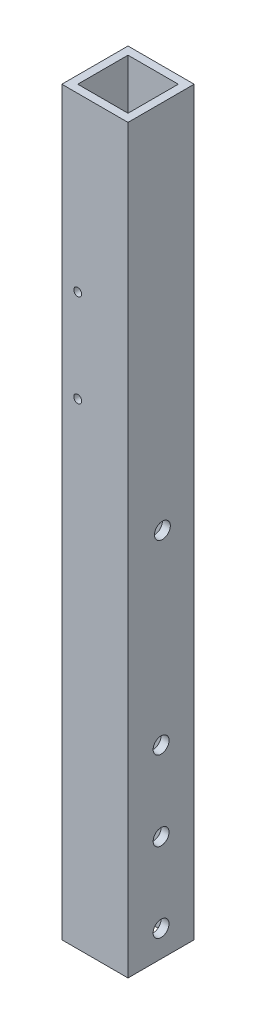
from build123d import *

# Parameters (mm, degrees)
SKETCH_1_W               = 25
SKETCH_1_H               = 25
SKETCH_1_W_2             = 19
SKETCH_1_H_2             = 19
EXTRUDE_1_DEPTH          = 280
SKETCH_2_R               = 3
CUT_EXTRUDE_1_DEPTH      = 283.223315833
CUT_EXTRUDE_2_DEPTH      = 283.223315833
CUT_EXTRUDE_2_DEPTH_BACK = 283.223315833
SKETCH_3_R               = 1.5


with BuildPart() as part:
    # 草图1 → 凸台-拉伸1 (new body)
    with BuildSketch(Plane(origin=(0, 0, 0), x_dir=(1, 0, 0), z_dir=(0, 1, 0))):
        with Locations((12.5, 12.5)):
            Rectangle(SKETCH_1_W, SKETCH_1_H)
        with Locations((12.5, 12.5)):
            Rectangle(SKETCH_1_W_2, SKETCH_1_H_2, mode=Mode.SUBTRACT)
    extrude(amount=EXTRUDE_1_DEPTH)

    # 草图2 → 切除-拉伸1 (cut, through all)
    with BuildSketch(Plane(origin=(0, 0, 0), x_dir=(0, 0, -1), z_dir=(1, 0, 0))):
        with Locations(Location((12.5, 10, 0), (0, 0, 180))):
            Circle(SKETCH_2_R)
        with Locations(Location((12.5, 40, 0), (0, 0, 180))):
            Circle(SKETCH_2_R)
        with Locations(Location((12.5, 70, 0), (0, 0, 180))):
            Circle(SKETCH_2_R)
        with Locations(Location((13, 140, 0), (0, 0, 180))):
            Circle(SKETCH_2_R)
    extrude(amount=CUT_EXTRUDE_1_DEPTH, mode=Mode.SUBTRACT)

    # 草图3 → 切除-拉伸2 (cut, two sides: drawn at the far end of the back side and taken through both)
    with BuildSketch(Plane.XY.offset(-CUT_EXTRUDE_2_DEPTH_BACK)):
        with Locations((6, 180)):
            Circle(SKETCH_3_R)
        with Locations((6, 215)):
            Circle(SKETCH_3_R)
    extrude(amount=CUT_EXTRUDE_2_DEPTH + CUT_EXTRUDE_2_DEPTH_BACK, mode=Mode.SUBTRACT)


solid = part.part
